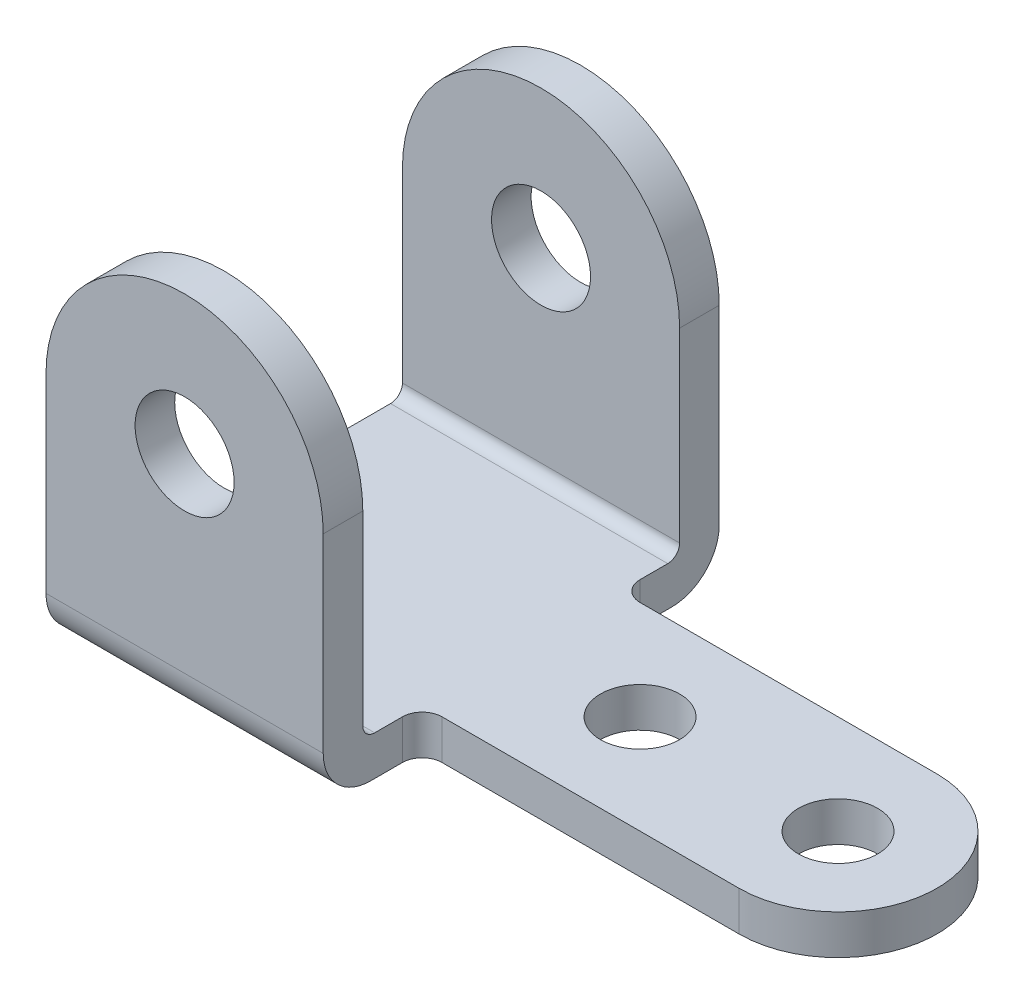
from build123d import *

# Parameters (mm, degrees)
BOSS_EXTRU_1_DEPTH      = 10
ESQUISSE4_W             = 70
ESQUISSE4_H             = 80
BOSS_EXTRU_2_DEPTH      = 10
BOSS_EXTRU_3_DEPTH      = 10
ESQUISSE7_R             = 12.5
ENL_V_MAT_EXTRU_2_DEPTH = 155.677082983
BOSS_EXTRU_4_DEPTH      = 10
ESQUISSE10_R            = 10
ENL_V_MAT_EXTRU_3_DEPTH = 219.746428542
CONG_1_R                = 5
CONG_5_R                = 12
CONG_6_R                = 12
CONG_7_R                = 3
CONG_8_R                = 3


with BuildPart() as part:
    # Esquisse1 → Boss.-Extru.1 (new body)
    with BuildSketch(Plane.XY):
        with BuildLine():
            Line((0, 0), (0, 60))
            ThreePointArc((0, 60), (35, 95), (70, 60))
            Line((70, 60), (70, 0))
            Line((70, 0), (0, 0))
        make_face()
    extrude(amount=BOSS_EXTRU_1_DEPTH)

    # Esquisse4 → Boss.-Extru.2 (add)
    with BuildSketch(Plane(origin=(0, 0, 0), x_dir=(-1, 0, 0), z_dir=(0, -1, 0))):
        with Locations((-35, -50)):
            Rectangle(ESQUISSE4_W, ESQUISSE4_H)
    extrude(amount=-BOSS_EXTRU_2_DEPTH)

    # Esquisse6 → Boss.-Extru.3 (add)
    with BuildSketch(Plane.XY.offset(90)):
        with BuildLine():
            Line((0, 0), (0, 60))
            ThreePointArc((0, 60), (35, 95), (70, 60))
            Line((70, 60), (70, 0))
            Line((70, 0), (0, 0))
        make_face()
    extrude(amount=BOSS_EXTRU_3_DEPTH)

    # Esquisse7 → Enlèv. mat.-Extru.2 (cut, through all)
    with BuildSketch(Plane.XY.offset(100)):
        with Locations((35, 60)):
            Circle(ESQUISSE7_R)
    extrude(amount=-ENL_V_MAT_EXTRU_2_DEPTH, mode=Mode.SUBTRACT)

    # Esquisse9 → Boss.-Extru.4 (add)
    with BuildSketch(Plane(origin=(0, 10, 0), x_dir=(1, 0, 0), z_dir=(0, 1, 0))):
        with BuildLine():
            Line((70, -25), (150, -25))
            ThreePointArc((150, -25), (175, -50), (150, -75))
            Line((150, -75), (70, -75))
            Line((70, -75), (70, -25))
        make_face()
    extrude(amount=-BOSS_EXTRU_4_DEPTH)

    # Esquisse10 → Enlèv. mat.-Extru.3 (cut, through all)
    with BuildSketch(Plane(origin=(0, 10, 0), x_dir=(1, 0, 0), z_dir=(0, 1, 0))):
        with Locations(Location((150, -50, 0), (0, 0, 180))):
            Circle(ESQUISSE10_R)
        with Locations(Location((100, -50, 0), (0, 0, 180))):
            Circle(ESQUISSE10_R)
    extrude(amount=-ENL_V_MAT_EXTRU_3_DEPTH, mode=Mode.SUBTRACT)

    # Congé1
    cong_1_edges = [part.edges().sort_by_distance(p)[0] for p in [
        (70, 5, 75),
        (70, 5, 25),
    ]]
    fillet(cong_1_edges, radius=CONG_1_R)

    # Congé5
    cong_5_edges = [part.edges().sort_by_distance(p)[0] for p in [
        (35, 0, 100),
    ]]
    fillet(cong_5_edges, radius=CONG_5_R)

    # Congé6
    cong_6_edges = [part.edges().sort_by_distance(p)[0] for p in [
        (35, 0, 0),
    ]]
    fillet(cong_6_edges, radius=CONG_6_R)

    # Congé7
    cong_7_edges = [part.edges().sort_by_distance(p)[0] for p in [
        (35, 10, 10),
    ]]
    fillet(cong_7_edges, radius=CONG_7_R)

    # Congé8
    cong_8_edges = [part.edges().sort_by_distance(p)[0] for p in [
        (35, 10, 90),
    ]]
    fillet(cong_8_edges, radius=CONG_8_R)


solid = part.part
